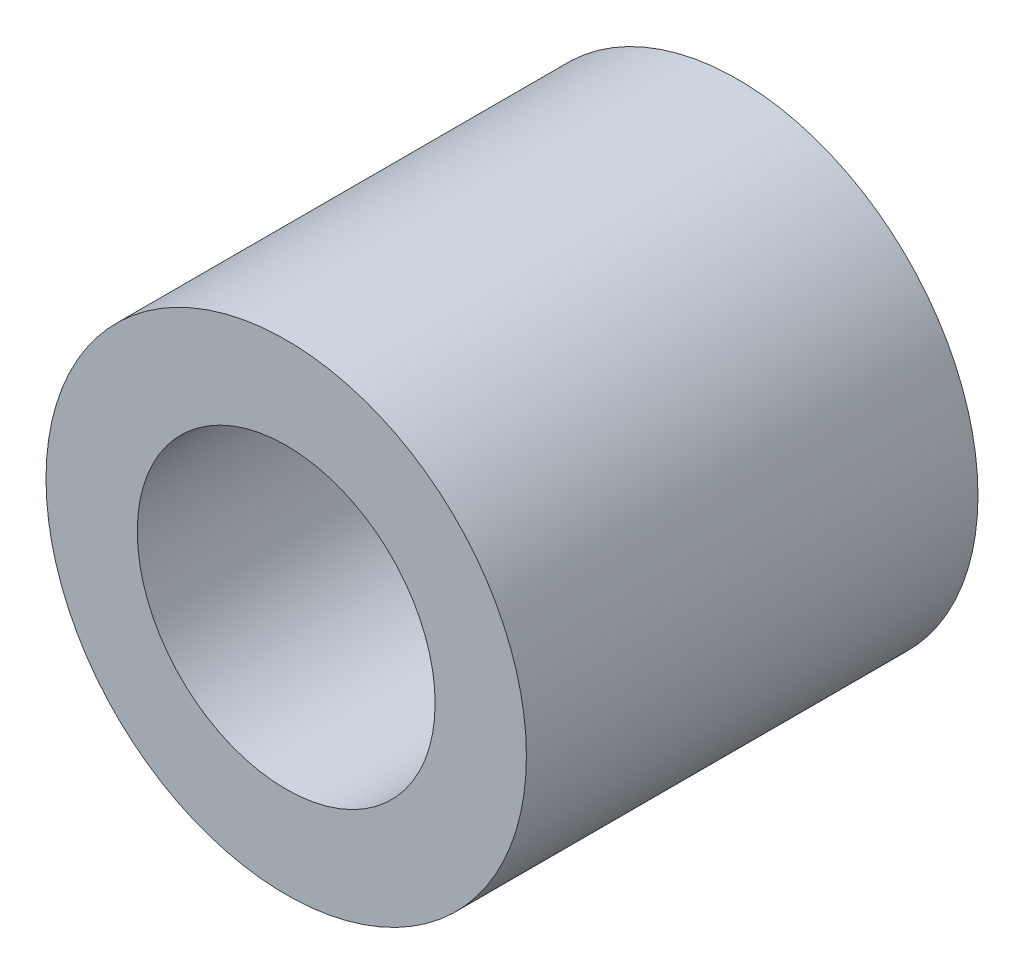
from build123d import *

# Parameters (mm, degrees)
ESQUISSE1_R        = 2.5
ESQUISSE1_R_2      = 1.55
BOSS_EXTRU_1_DEPTH = 4.7


with BuildPart() as part:
    # Esquisse1 → Boss.-Extru.1 (new body)
    with BuildSketch(Plane.XY):
        Circle(ESQUISSE1_R)
        Circle(ESQUISSE1_R_2, mode=Mode.SUBTRACT)
    extrude(amount=BOSS_EXTRU_1_DEPTH)


solid = part.part
